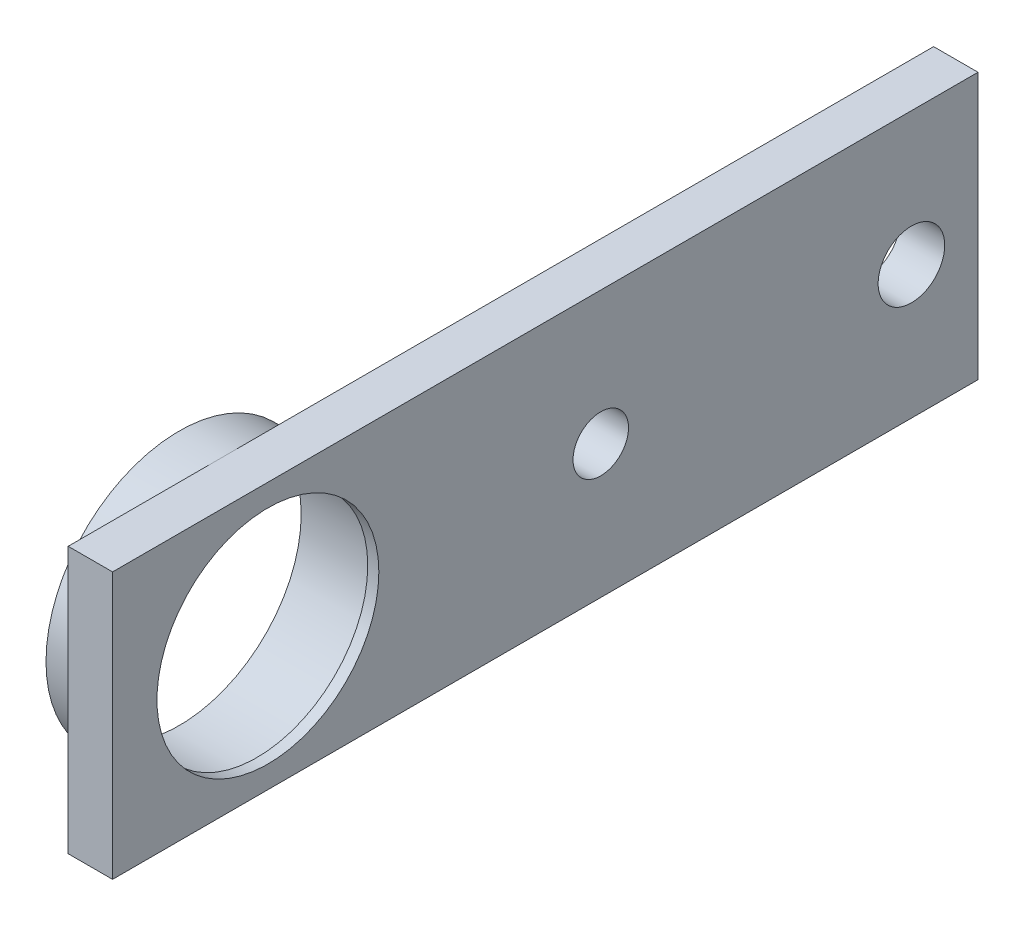
from build123d import *

# Parameters (mm, degrees)
SKETCH1_W           = 123.825
SKETCH1_H           = 38.1
SKETCH1_R           = 17.4625
SKETCH1_R_2         = 3.96875
SKETCH1_R_3         = 4.7625
BOSS_EXTRUDE1_DEPTH = 6.35
BOSS_EXTRUDE3_START = -1.5875
SKETCH3_R           = 17.4625
SKETCH3_R_2         = 15.875
BOSS_EXTRUDE3_DEPTH = 1.5875
BOSS_EXTRUDE5_START = 6.35
SKETCH5_R           = 19.05
SKETCH5_R_2         = 17.4625
BOSS_EXTRUDE5_DEPTH = 6.35


with BuildPart() as part:
    # Sketch1 → Boss-Extrude1 (new body)
    with BuildSketch(Plane(origin=(0, 0, 0), x_dir=(0, 0, -1), z_dir=(1, 0, 0))):
        with Locations((61.9125, 19.05)):
            Rectangle(SKETCH1_W, SKETCH1_H)
        with Locations((22.225, 19.05)):
            Circle(SKETCH1_R, mode=Mode.SUBTRACT)
        with Locations((69.85, 19.05)):
            Circle(SKETCH1_R_2, mode=Mode.SUBTRACT)
        with Locations((114.3, 19.05)):
            Circle(SKETCH1_R_3, mode=Mode.SUBTRACT)
    extrude(amount=BOSS_EXTRUDE1_DEPTH)

    # Sketch3 → Boss-Extrude3 (add)
    with BuildSketch(Plane(origin=(6.35, 0, 0), x_dir=(0, 0, -1), z_dir=(1, 0, 0)).offset(BOSS_EXTRUDE3_START)):
        with Locations((22.225, 19.05)):
            Circle(SKETCH3_R)
        with Locations((22.225, 19.05)):
            Circle(SKETCH3_R_2, mode=Mode.SUBTRACT)
    extrude(amount=BOSS_EXTRUDE3_DEPTH)

    # Sketch5 → Boss-Extrude5 (add)
    with BuildSketch(Plane.ZY.offset(BOSS_EXTRUDE5_START)):
        with Locations(Location((-22.225, 19.05, 0), (0, 0, 270))):
            Circle(SKETCH5_R)
        with Locations((-22.225, 19.05)):
            Circle(SKETCH5_R_2, mode=Mode.SUBTRACT)
    extrude(amount=-BOSS_EXTRUDE5_DEPTH)


solid = part.part
